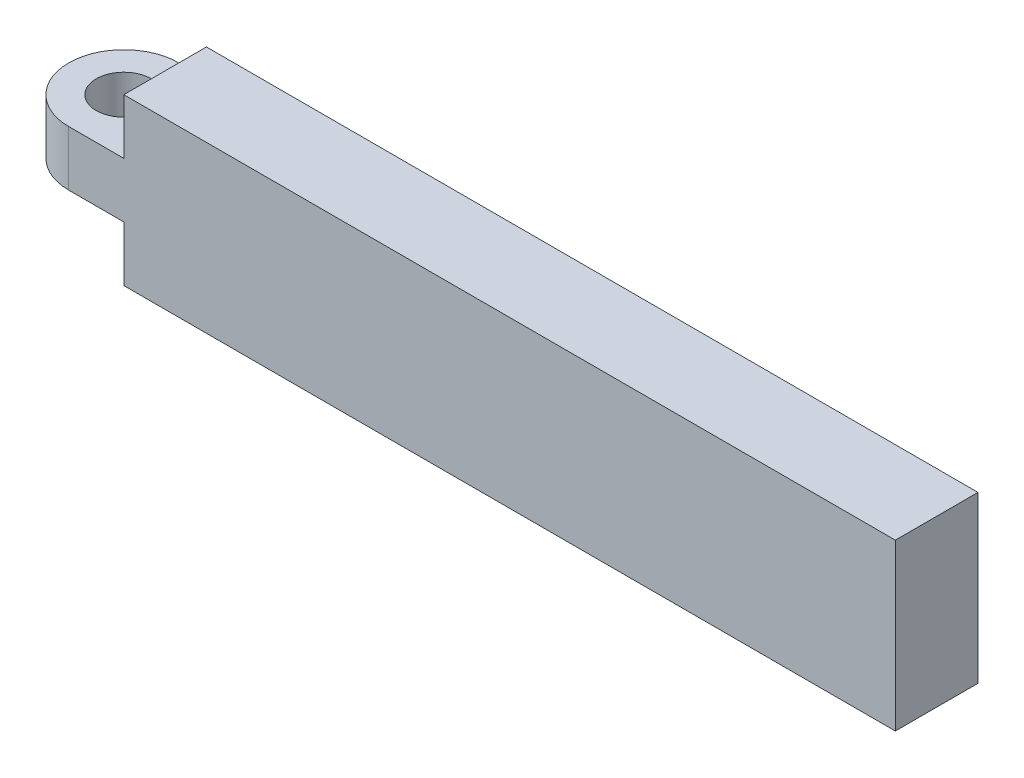
from build123d import *

# Parameters (mm, degrees)
SKETCH1_W           = 14
SKETCH1_H           = 2
BOSS_EXTRUDE1_DEPTH = 3
CHAMFER1_SIZE       = 0.5
SKETCH2_W           = 2
SKETCH2_H           = 1
BOSS_EXTRUDE2_DEPTH = 2
SKETCH3_R           = 0.5
CUT_EXTRUDE1_DEPTH  = 2


with BuildPart() as part:
    # Sketch1 → Boss-Extrude1 (new body)
    with BuildSketch(Plane(origin=(0, 0, 0), x_dir=(1, 0, 0), z_dir=(0, 1, 0))):
        Rectangle(SKETCH1_W, SKETCH1_H)
    extrude(amount=BOSS_EXTRUDE1_DEPTH)

    # Chamfer1
    chamfer1_edges = [part.edges().sort_by_distance(p)[0] for p in [
        (0, 0, -1),
        (7, 1.5, -1),
        (0, 3, -1),
    ]]
    chamfer(chamfer1_edges, length=CHAMFER1_SIZE)

    # Sketch2 → Boss-Extrude2 (add)
    with BuildSketch(Plane.ZY.offset(7)):
        with Locations((0, 1.5)):
            Rectangle(SKETCH2_W, SKETCH2_H)
    extrude(amount=BOSS_EXTRUDE2_DEPTH)

    # Sketch3 → Cut-Extrude1 (cut)
    with BuildSketch(Plane(origin=(0, 2, 0), x_dir=(1, 0, 0), z_dir=(0, 1, 0))):
        with Locations(Location((-8, 0, 0), (0, 0, 270))):
            Circle(SKETCH3_R)
        with BuildLine():
            ThreePointArc((-9, 0), (-8.707106781, 0.707106781), (-8, 1))
            Line((-8, 1), (-9, 1))
            Line((-9, 1), (-9, 0))
        make_face()
        with BuildLine():
            Line((-9, -1), (-8, -1))
            ThreePointArc((-8, -1), (-8.707106781, -0.707106781), (-9, 0))
            Line((-9, 0), (-9, -1))
        make_face()
    extrude(amount=-CUT_EXTRUDE1_DEPTH, mode=Mode.SUBTRACT)


solid = part.part
